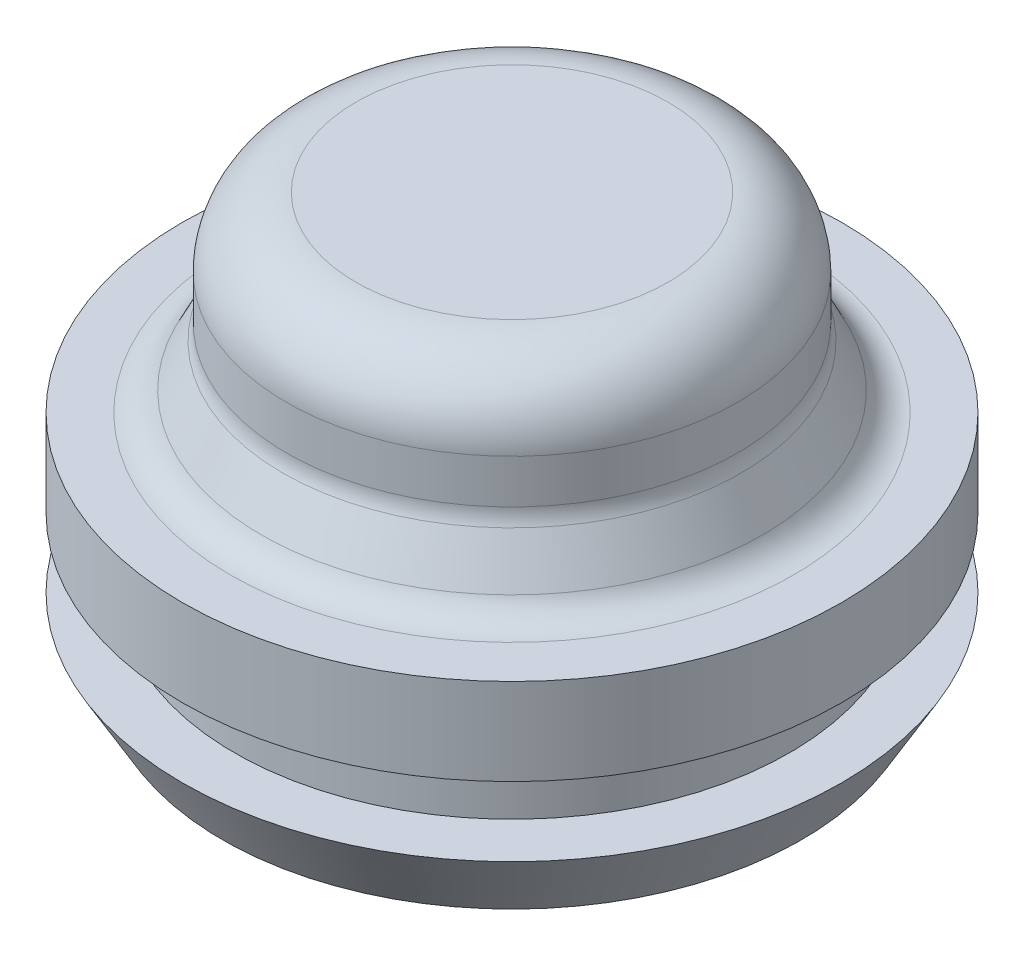
from build123d import *


with BuildPart() as part:
    # Esquisse1 → Révolution1 (revolve)
    with BuildSketch(Plane.XY, mode=Mode.PRIVATE) as r_volution1_sk:
        with BuildLine():
            Line((8.345299462, 0), (6.3, 0))
            Line((6.3, 0), (5.404996879, 0.895003121))
            ThreePointArc((5.404996879, 0.895003121), (5.998873428, 3.616265174), (5.3, 6.312472222))
            Line((5.3, 6.312472222), (5.3, 10))
            ThreePointArc((5.3, 10), (5.007106781, 10.707106781), (4.3, 11))
            Line((4.3, 11), (0, 11))
            Line((0, 11), (0, 12))
            Line((0, 12), (4.5, 12))
            ThreePointArc((4.5, 12), (5.914213562, 11.414213562), (6.5, 10))
            Line((6.5, 10), (6.5, 8.736067977))
            ThreePointArc((6.5, 8.736067977), (6.526751011, 8.506315057), (6.605572809, 8.288854382))
            Line((6.605572809, 8.288854382), (7.223606798, 7.052786405))
            ThreePointArc((7.223606798, 7.052786405), (7.592302877, 6.649349192), (8.118033989, 6.5))
            Line((8.118033989, 6.5), (9.5, 6.5))
            Line((9.5, 6.5), (9.5, 4))
            Line((9.5, 4), (8, 4))
            Line((8, 4), (8, 2))
            Line((8, 2), (9.5, 2))
            Line((9.5, 2), (8.345299462, 0))
        make_face()
    revolve(r_volution1_sk.sketch.rotate(Axis((0, 0, 0), (0, 1, 0)), 90), axis=Axis((0, 0, 0), (0, 1, 0)))


solid = part.part
